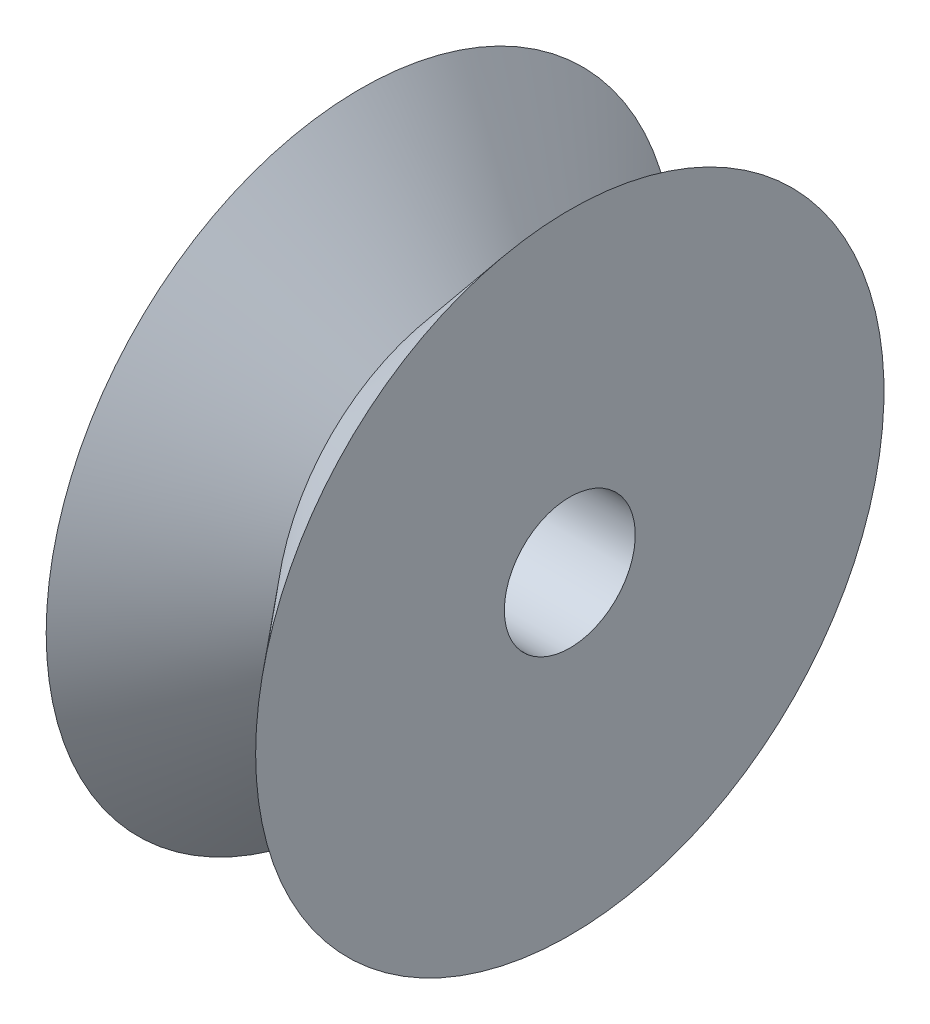
from build123d import *

# Parameters (mm, degrees)
SKETCH2_R          = 2.5
CUT_EXTRUDE1_DEPTH = 10


with BuildPart() as part:
    # Sketch1 → Revolve1 (revolve)
    with BuildSketch(Plane(origin=(0, 0, 0), x_dir=(1, 0, 0), z_dir=(0, 1, 0)), mode=Mode.PRIVATE) as revolve1_sk:
        Polygon((4, 0), (-4, 0), (-4, 12), (0, 7.23298563), (4, 12), align=None)
    revolve(revolve1_sk.sketch.rotate(Axis((-23.801041794, 0, 0), (1, 0, 0)), 180), axis=Axis((-23.801041794, 0, 0), (1, 0, 0)))

    # Sketch2 → Cut-Extrude1 (cut)
    with BuildSketch(Plane.ZY.offset(4)):
        Circle(SKETCH2_R)
    extrude(amount=-CUT_EXTRUDE1_DEPTH, mode=Mode.SUBTRACT)


solid = part.part
